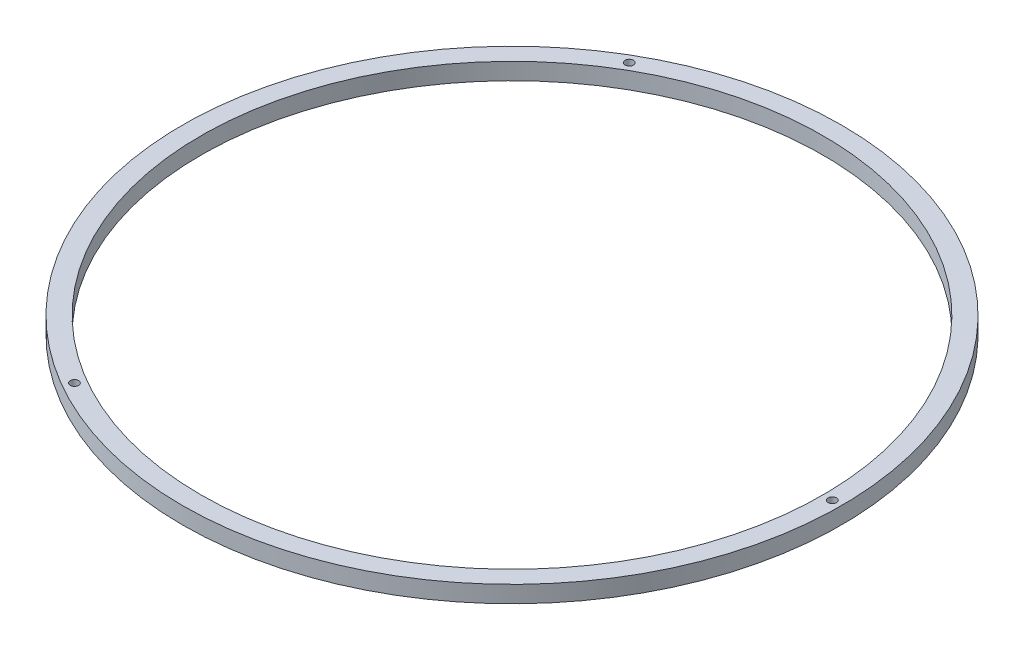
from build123d import *

# Parameters (mm, degrees)
SKETCH_2_R      = 196
SKETCH_2_R_2    = 185
SKETCH_2_R_3    = 2.5
EXTRUDE_1_DEPTH = 10


with BuildPart() as part:
    # 草图2 → 凸台-拉伸1 (new body)
    with BuildSketch(Plane(origin=(0, 0, 0), x_dir=(1, 0, 0), z_dir=(0, 1, 0))):
        with Locations(Location((0, 0, 0), (0, 0, 270))):
            Circle(SKETCH_2_R)
        with Locations(Location((0, 0, 0), (0, 0, 270))):
            Circle(SKETCH_2_R_2, mode=Mode.SUBTRACT)
        with Locations(Location((-95.262794416, 165, 0), (0, 0, 270))):
            Circle(SKETCH_2_R_3, mode=Mode.SUBTRACT)
        with Locations(Location((190.525588833, 0, 0), (0, 0, 270))):
            Circle(SKETCH_2_R_3, mode=Mode.SUBTRACT)
        with Locations(Location((-95.262794416, -165, 0), (0, 0, 270))):
            Circle(SKETCH_2_R_3, mode=Mode.SUBTRACT)
    extrude(amount=EXTRUDE_1_DEPTH)


solid = part.part
